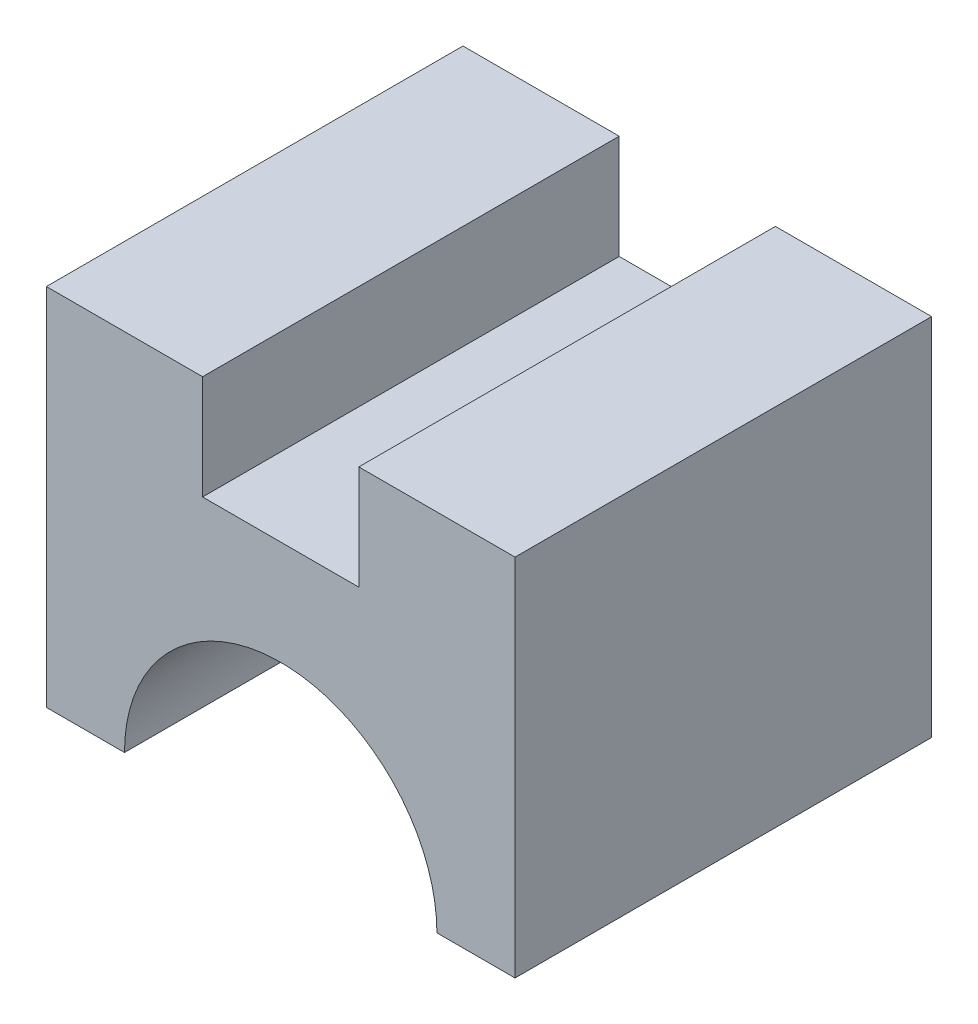
from build123d import *

# Parameters (mm, degrees)
BOSS_EXTRUDE1_DEPTH = 1016


with BuildPart() as part:
    # Sketch1 → Boss-Extrude1 (new body)
    with BuildSketch(Plane.XY):
        with BuildLine():
            Line((-381, 0), (-571.5, 0))
            Line((-571.5, 0), (-571.5, 889))
            Line((-571.5, 889), (-190.5, 889))
            Line((-190.5, 889), (-190.5, 635))
            Line((-190.5, 635), (190.5, 635))
            Line((190.5, 635), (190.5, 889))
            Line((190.5, 889), (571.5, 889))
            Line((571.5, 889), (571.5, 0))
            Line((571.5, 0), (381, 0))
            ThreePointArc((381, 0), (0, 381), (-381, 0))
        make_face()
    extrude(amount=BOSS_EXTRUDE1_DEPTH)


solid = part.part
